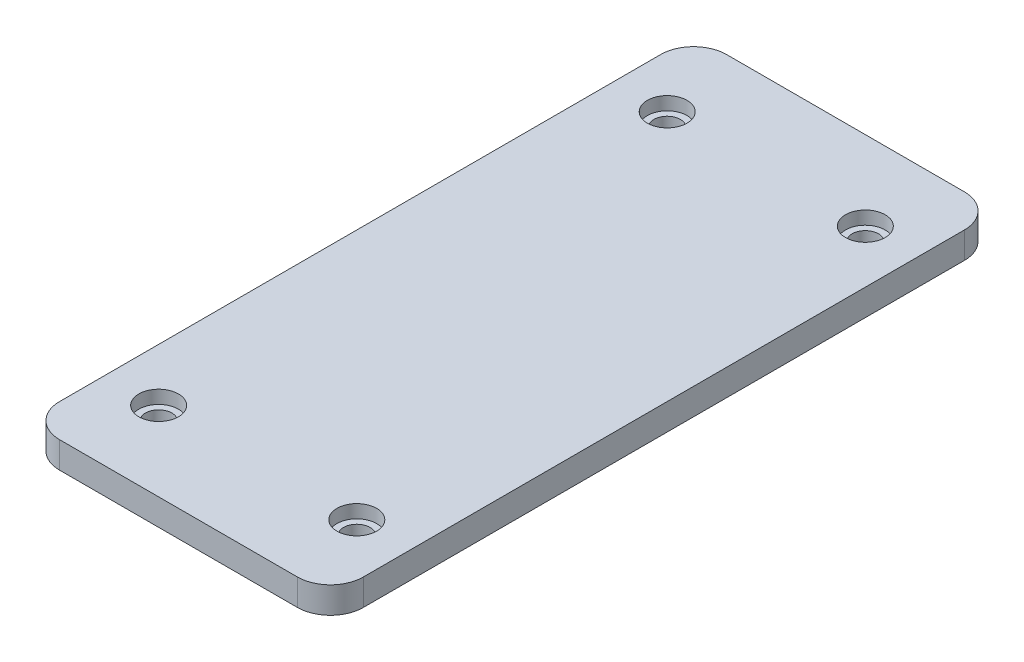
from build123d import *

# Parameters (mm, degrees)
CROQUIS1_W              = 46
CROQUIS1_H              = 101
SALIENTE_EXTRUIR2_DEPTH = 4
CROQUIS2_R              = 2
CORTAR_EXTRUIR3_DEPTH   = 36
CROQUIS4_R              = 3
CORTAR_EXTRUIR4_DEPTH   = 2
REDONDEO1_R             = 5


with BuildPart() as part:
    # Croquis1 → Saliente-Extruir2 (new body)
    with BuildSketch(Plane(origin=(0, 0, 0), x_dir=(1, 0, 0), z_dir=(0, 1, 0))):
        Rectangle(CROQUIS1_W, CROQUIS1_H)
    extrude(amount=SALIENTE_EXTRUIR2_DEPTH)

    # Croquis2 → Cortar-Extruir3 (cut)
    with BuildSketch(Plane(origin=(0, 4, 0), x_dir=(1, 0, 0), z_dir=(0, 1, 0))):
        with Locations(Location((-15, 38.5, 0), (0, 0, 270))):
            Circle(CROQUIS2_R)
        with Locations(Location((15, 38.5, 0), (0, 0, 270))):
            Circle(CROQUIS2_R)
        with Locations(Location((-15, -38.5, 0), (0, 0, 270))):
            Circle(CROQUIS2_R)
        with Locations(Location((15, -38.5, 0), (0, 0, 270))):
            Circle(CROQUIS2_R)
    extrude(amount=-CORTAR_EXTRUIR3_DEPTH, mode=Mode.SUBTRACT)

    # Croquis4 → Cortar-Extruir4 (cut)
    with BuildSketch(Plane(origin=(0, 4, 0), x_dir=(1, 0, 0), z_dir=(0, 1, 0))):
        with Locations(Location((-15, -38.5, 0), (0, 0, 270))):
            Circle(CROQUIS4_R)
        with Locations(Location((15, -38.5, 0), (0, 0, 270))):
            Circle(CROQUIS4_R)
        with Locations(Location((-15, 38.5, 0), (0, 0, 270))):
            Circle(CROQUIS4_R)
        with Locations(Location((15, 38.5, 0), (0, 0, 270))):
            Circle(CROQUIS4_R)
    extrude(amount=-CORTAR_EXTRUIR4_DEPTH, mode=Mode.SUBTRACT)

    # Redondeo1
    redondeo1_edges = [part.edges().sort_by_distance(p)[0] for p in [
        (23, 2, 50.5),
        (-23, 2, 50.5),
        (-23, 2, -50.5),
        (23, 2, -50.5),
    ]]
    fillet(redondeo1_edges, radius=REDONDEO1_R)


solid = part.part
